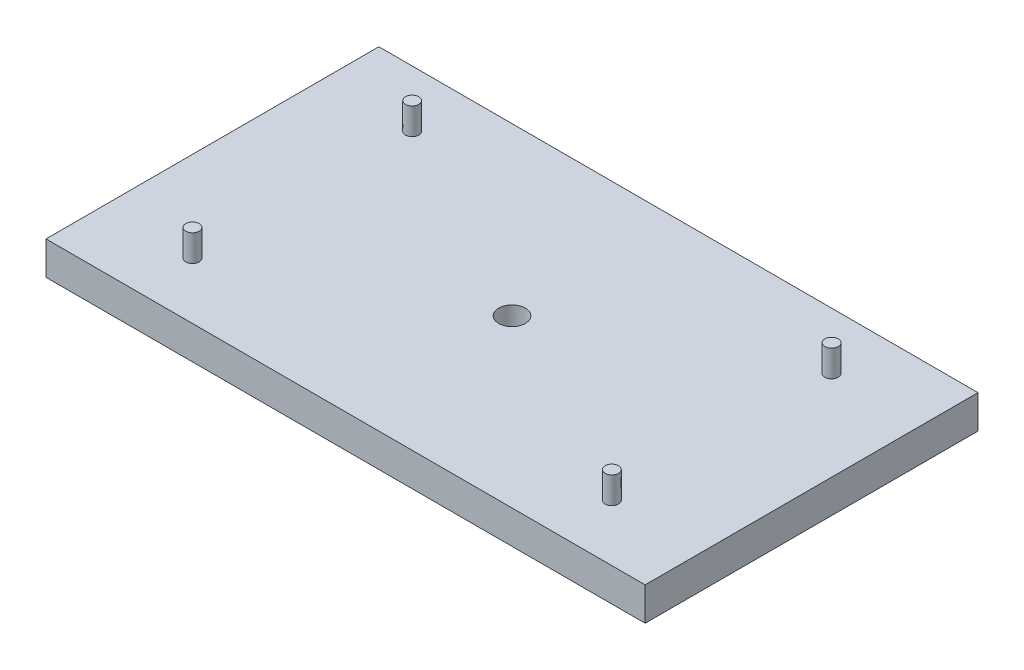
from build123d import *

# Parameters (mm, degrees)
SKETCH2_W           = 90
SKETCH2_H           = 50
BOSS_EXTRUDE2_DEPTH = 5
SKETCH4_R           = 1
BOSS_EXTRUDE3_DEPTH = 4
SKETCH5_R           = 2
CUT_EXTRUDE1_DEPTH  = 18


with BuildPart() as part:
    # Sketch2 → Boss-Extrude2 (new body)
    with BuildSketch(Plane(origin=(0, 0, 0), x_dir=(1, 0, 0), z_dir=(0, 1, 0))):
        with Locations((-113.562992126, 38.956692913)):
            Rectangle(SKETCH2_W, SKETCH2_H)
    extrude(amount=BOSS_EXTRUDE2_DEPTH)

    # Sketch4 → Boss-Extrude3 (add)
    with BuildSketch(Plane(origin=(0, 5, 0), x_dir=(1, 0, 0), z_dir=(0, 1, 0))):
        with Locations(Location((-145.062992126, 22.456692913, 0), (0, 0, 270))):
            Circle(SKETCH4_R)
        with Locations(Location((-145.062992126, 55.456692913, 0), (0, 0, 270))):
            Circle(SKETCH4_R)
        with Locations(Location((-82.062992126, 55.456692913, 0), (0, 0, 270))):
            Circle(SKETCH4_R)
        with Locations(Location((-82.062992126, 22.456692913, 0), (0, 0, 270))):
            Circle(SKETCH4_R)
    extrude(amount=BOSS_EXTRUDE3_DEPTH)

    # Sketch5 → Cut-Extrude1 (cut)
    with BuildSketch(Plane.XZ):
        with Locations(Location((-113.562992126, -38.956692913, 0), (0, 0, 270))):
            Circle(SKETCH5_R)
    extrude(amount=-CUT_EXTRUDE1_DEPTH, mode=Mode.SUBTRACT)


solid = part.part
